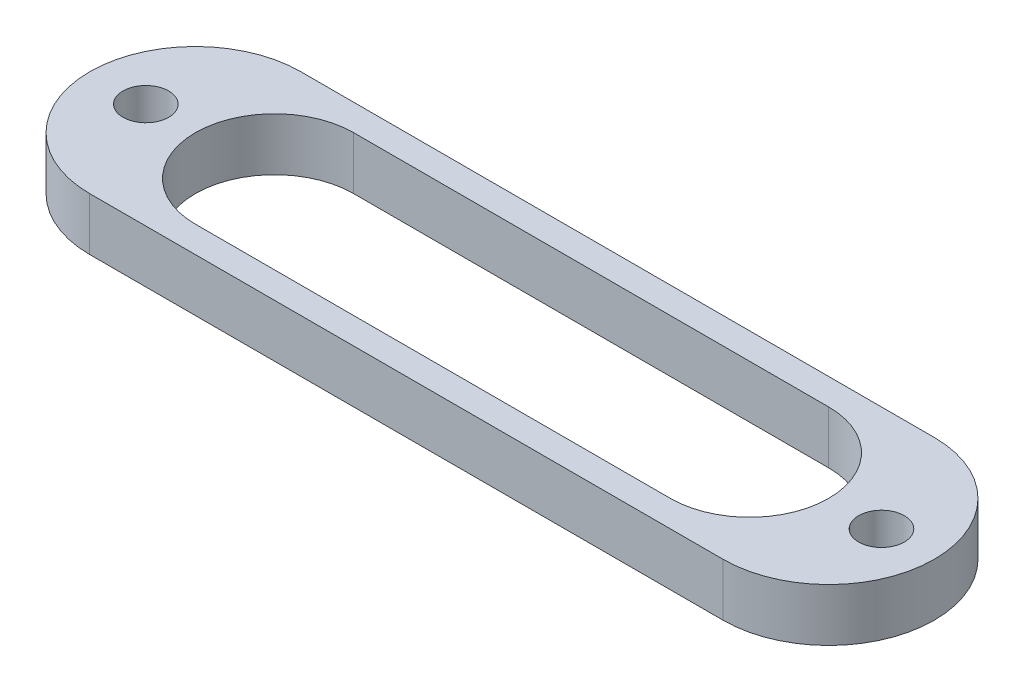
from build123d import *

# Parameters (mm, degrees)
BOSS_EXTRUDE1_DEPTH  = 6.35
M5_CLEARANCE_HOLE1_D = 5.5


with BuildPart() as part:
    # Sketch2 → Boss-Extrude1 (new body)
    with BuildSketch(Plane(origin=(0, 0, 0), x_dir=(1, 0, 0), z_dir=(0, 1, 0))):
        with BuildLine():
            Line((0, 12.7), (76.2, 12.7))
            ThreePointArc((76.2, 12.7), (88.9, 0), (76.2, -12.7))
            Line((76.2, -12.7), (0, -12.7))
            ThreePointArc((0, -12.7), (-12.7, 0), (0, 12.7))
        make_face()
        with BuildLine():
            Line((9.525, 9.525), (66.675, 9.525))
            ThreePointArc((66.675, 9.525), (76.2, 0), (66.675, -9.525))
            Line((66.675, -9.525), (9.525, -9.525))
            ThreePointArc((9.525, -9.525), (0, 0), (9.525, 9.525))
        make_face(mode=Mode.SUBTRACT)
    extrude(amount=BOSS_EXTRUDE1_DEPTH)

    # M5 Clearance Hole1 (through all)
    with Locations(Plane(origin=(0, 6.35, 0), x_dir=(1, 0, 0), z_dir=(0, 1, 0))):
        with Locations((-5.950002807, 0), (82.55, 0)):
            Hole(M5_CLEARANCE_HOLE1_D / 2)


solid = part.part
